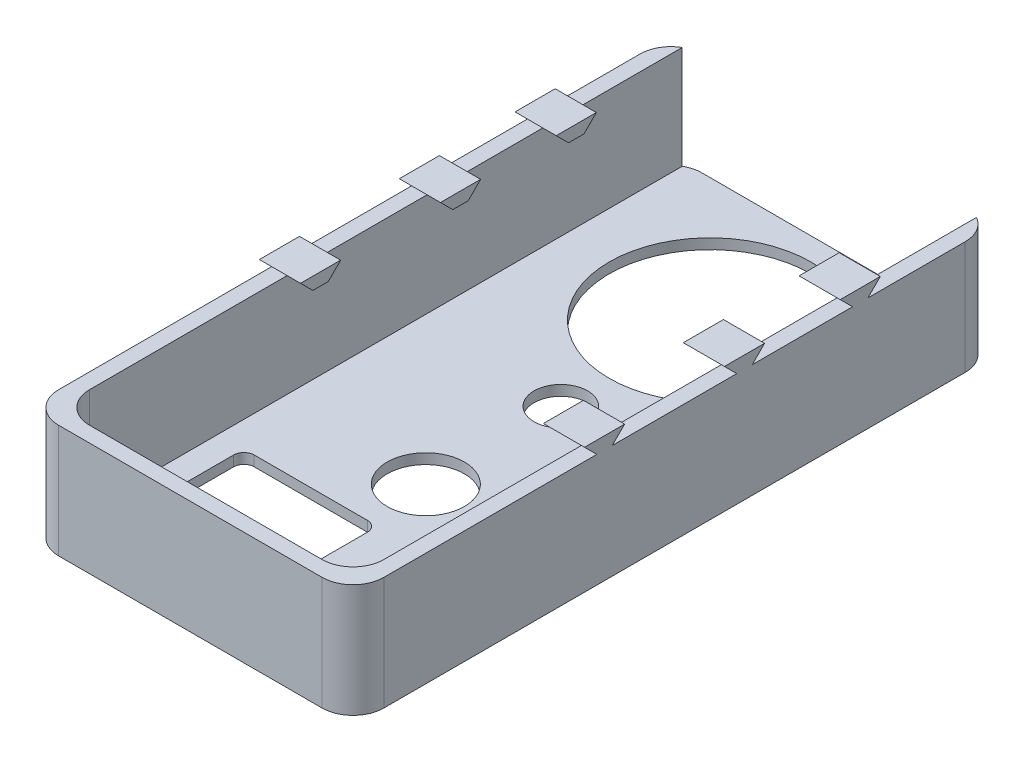
from build123d import *

# Parameters (mm, degrees)
SKETCH1_W           = 80.264
SKETCH1_H           = 158.75
BOSS_EXTRUDE1_DEPTH = 2.54
BOSS_EXTRUDE2_DEPTH = 25.4
FILLET1_R           = 7.62
SKETCH7_R           = 6.604
SKETCH7_R_2         = 9.525
SKETCH7_R_3         = 24.892
CUT_EXTRUDE1_DEPTH  = 181.068086556
BOSS_EXTRUDE3_DEPTH = 10.16


with BuildPart() as part:
    # Sketch1 → Boss-Extrude1 (new body)
    with BuildSketch(Plane(origin=(0, 0, 0), x_dir=(1, 0, 0), z_dir=(0, 1, 0))):
        with Locations((40.132, -79.375)):
            Rectangle(SKETCH1_W, SKETCH1_H)
    extrude(amount=BOSS_EXTRUDE1_DEPTH)

    # Sketch2 → Boss-Extrude2 (add)
    with BuildSketch(Plane(origin=(0, 2.54, 0), x_dir=(1, 0, 0), z_dir=(0, 1, 0))):
        with BuildLine():
            Line((3.81, -147.32), (3.81, -11.43))
            Line((3.81, -11.43), (3.81, 0))
            Line((3.81, 0), (0, 0))
            Line((0, 0), (0, -158.75))
            Line((0, -158.75), (80.264, -158.75))
            Line((80.264, -158.75), (80.264, 0))
            Line((80.264, 0), (76.454, 0))
            Line((76.454, 0), (76.454, -11.43))
            Line((76.454, -11.43), (76.454, -147.32))
            ThreePointArc((76.454, -147.32), (74.222153673, -152.708153673), (68.834, -154.94))
            Line((68.834, -154.94), (11.43, -154.94))
            ThreePointArc((11.43, -154.94), (6.041846327, -152.708153673), (3.81, -147.32))
        make_face()
    extrude(amount=BOSS_EXTRUDE2_DEPTH)

    # Fillet1
    fillet1_edges = [part.edges().sort_by_distance(p)[0] for p in [
        (0, 13.97, 0),
        (80.264, 13.97, 0),
        (80.264, 13.97, 158.75),
        (0, 13.97, 158.75),
    ]]
    fillet(fillet1_edges, radius=FILLET1_R)

    # Sketch7 → Cut-Extrude1 (cut, through all)
    with BuildSketch(Plane.XZ):
        with Locations(Location((40.132, 67.31, 0), (0, 0, 270))):
            Circle(SKETCH7_R)
        with Locations(Location((40.132, 100.6475, 0), (0, 0, 270))):
            Circle(SKETCH7_R_2)
        with Locations(Location((40.132, 30.48, 0), (0, 0, 270))):
            Circle(SKETCH7_R_3)
        with BuildLine():
            Line((40.64, 148.59), (12.7, 148.59))
            ThreePointArc((12.7, 148.59), (10.903948776, 147.846051224), (10.16, 146.05))
            Line((10.16, 146.05), (10.16, 118.11))
            ThreePointArc((10.16, 118.11), (10.903948776, 116.313948776), (12.7, 115.57))
            Line((12.7, 115.57), (40.64, 115.57))
            ThreePointArc((40.64, 115.57), (42.436051224, 116.313948776), (43.18, 118.11))
            Line((43.18, 118.11), (43.18, 146.05))
            ThreePointArc((43.18, 146.05), (42.436051224, 147.846051224), (40.64, 148.59))
        make_face()
    extrude(amount=-CUT_EXTRUDE1_DEPTH, mode=Mode.SUBTRACT)

    # Sketch8 → Boss-Extrude3 (add)
    with BuildSketch(Plane(origin=(80.264, 0, 0), x_dir=(0, 0, -1), z_dir=(1, 0, 0))):
        Polygon((-98.552, 27.94), (-101.6, 30.988), (-91.694, 30.988), (-94.742, 27.94), align=None)
        Polygon((-64.008, 27.94), (-60.198, 27.94), (-57.15, 30.988), (-67.056, 30.988), align=None)
        Polygon((-38.481, 30.988), (-35.433, 27.94), (-31.623, 27.94), (-28.575, 30.988), align=None)
    boss_extrude3 = extrude(amount=-BOSS_EXTRUDE3_DEPTH)

    # Mirror3: Boss-Extrude3 across plane
    add(boss_extrude3.mirror(Plane(origin=(40.132, 0, 0), x_dir=(0, 0, 1), z_dir=(1, 0, 0))))


solid = part.part
